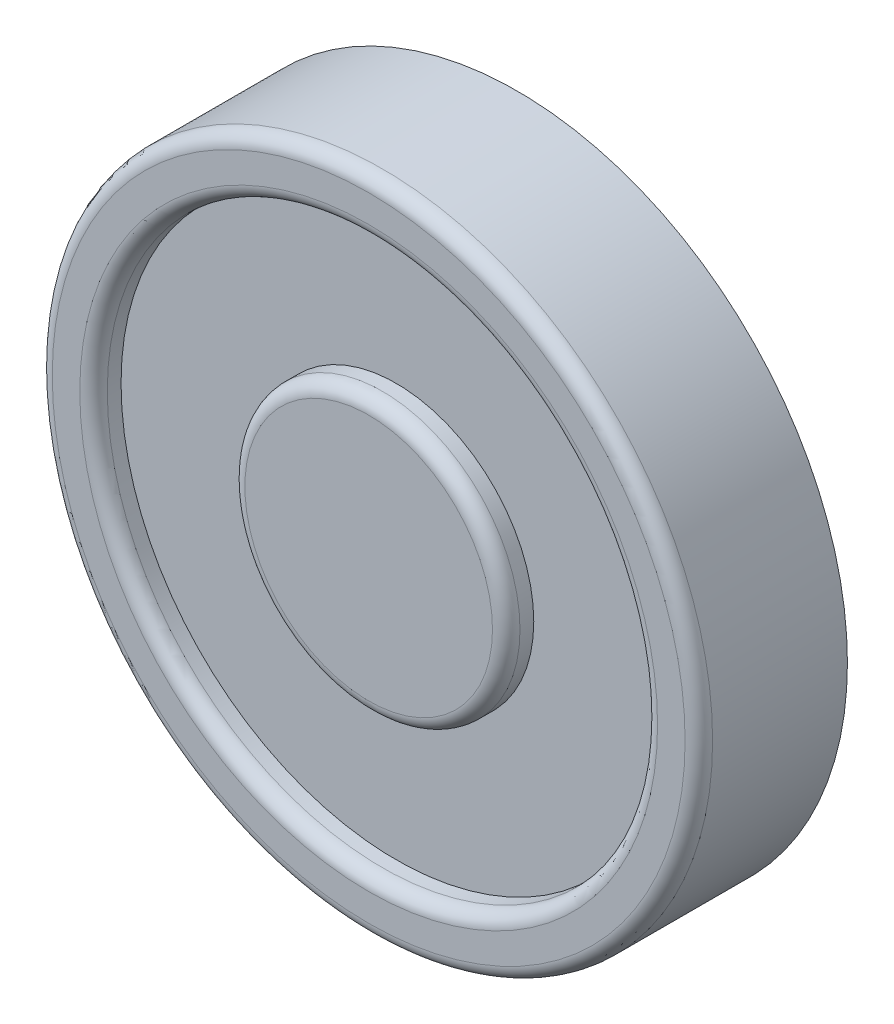
from build123d import *

# Parameters (mm, degrees)
SKETCH1_R           = 2.4
BOSS_EXTRUDE1_DEPTH = 1.08
SKETCH2_R           = 2
SKETCH2_R_2         = 1
CUT_EXTRUDE1_DEPTH  = 0.2
FILLET2_R           = 0.1
SKETCH3_R           = 0.5
CUT_EXTRUDE2_DEPTH  = 0.2


with BuildPart() as part:
    # Sketch1 → Boss-Extrude1 (new body)
    with BuildSketch(Plane.XY):
        with Locations((-2.627899096, 3.372164225)):
            Circle(SKETCH1_R)
    extrude(amount=BOSS_EXTRUDE1_DEPTH)

    # Sketch2 → Cut-Extrude1 (cut)
    with BuildSketch(Plane.XY.offset(1.08)):
        with Locations((-2.627899096, 3.372164225)):
            Circle(SKETCH2_R)
        with Locations((-2.627899096, 3.372164225)):
            Circle(SKETCH2_R_2, mode=Mode.SUBTRACT)
    extrude(amount=-CUT_EXTRUDE1_DEPTH, mode=Mode.SUBTRACT)

    # Fillet2
    fillet2_edges = [part.edges().sort_by_distance(p)[0] for p in [
        (-5.027899096, 3.372164225, 1.08),
        (-4.627899096, 3.372164225, 1.08),
        (-3.627899096, 3.372164225, 1.08),
    ]]
    fillet(fillet2_edges, radius=FILLET2_R)

    # Sketch3 → Cut-Extrude2 (cut)
    with BuildSketch(Plane(origin=(0, 0, 0), x_dir=(-1, 0, 0), z_dir=(0, 0, -1))):
        with Locations((2.627899096, 3.372164225)):
            Circle(SKETCH3_R)
    extrude(amount=-CUT_EXTRUDE2_DEPTH, mode=Mode.SUBTRACT)


solid = part.part
